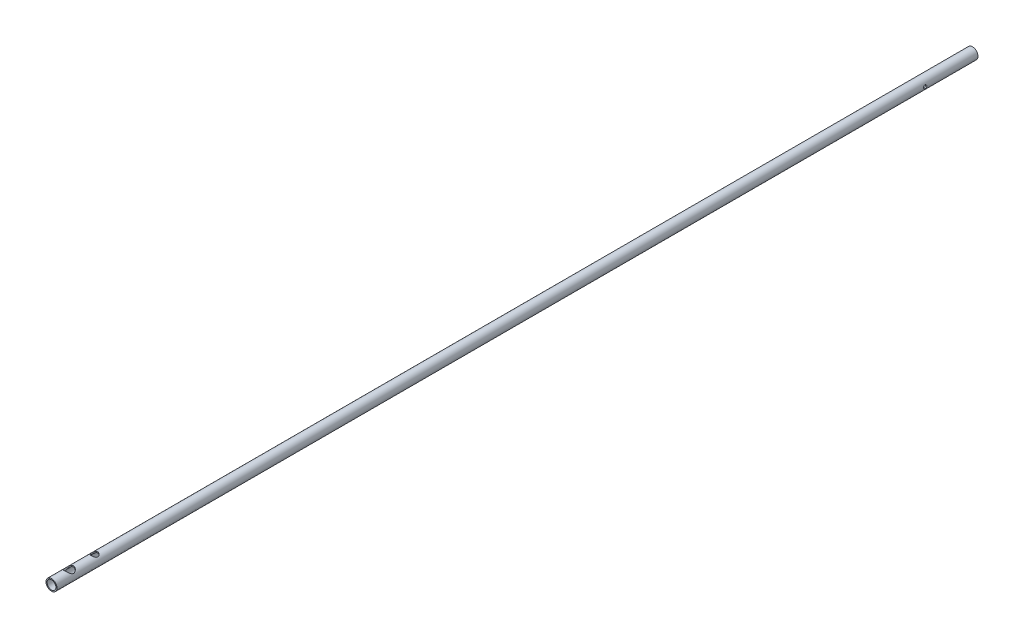
from build123d import *

# Parameters (mm, degrees)
SKETCH_1_R               = 5
SKETCH_1_R_2             = 4
EXTRUDE_1_DEPTH          = 836.5
CUT_EXTRUDE_1_DEPTH      = 837.529885898
CUT_EXTRUDE_1_DEPTH_BACK = 837.529885898
SKETCH_2_R               = 2
SKETCH_2_R_2             = 1.5
SKETCH_2_3_R             = 4
SKETCH_2_3_R_2           = 3
CUT_EXTRUDE_2_DEPTH      = 837.529885999
CUT_EXTRUDE_3_DEPTH      = 837.529885999
CUT_EXTRUDE_3_DEPTH_BACK = 837.529885999
SKETCH_3_R               = 1.5
SKETCH_3_3_R             = 3
CUT_EXTRUDE_4_DEPTH      = 10


with BuildPart() as part:
    # ｽｹｯﾁ1 → 押し出し-薄板1 (new body)
    with BuildSketch(Plane.XY):
        Circle(SKETCH_1_R)
        Circle(SKETCH_1_R_2, mode=Mode.SUBTRACT)
    extrude(amount=EXTRUDE_1_DEPTH)

    # ｽｹｯﾁ2 → ｶｯﾄ - 押し出し1 (cut, two sides: drawn at the far end of the back side and taken through both)
    with BuildSketch(Plane(origin=(0, 0, 0), x_dir=(1, 0, 0), z_dir=(0, 1, 0)).offset(-CUT_EXTRUDE_1_DEPTH_BACK)):
        with Locations((0, -820.5)):
            Circle(SKETCH_2_R)
        with Locations((0, -797.5)):
            Circle(SKETCH_2_R_2)
    extrude(amount=CUT_EXTRUDE_1_DEPTH + CUT_EXTRUDE_1_DEPTH_BACK, mode=Mode.SUBTRACT)

    # ｽｹｯﾁ2<3> → ｶｯﾄ - 押し出し2 (cut, through all)
    with BuildSketch(Plane(origin=(0, 0, 0), x_dir=(1, 0, 0), z_dir=(0, 1, 0))):
        with Locations((0, -820.5)):
            Circle(SKETCH_2_3_R)
        with Locations((0, -797.5)):
            Circle(SKETCH_2_3_R_2)
    extrude(amount=CUT_EXTRUDE_2_DEPTH, mode=Mode.SUBTRACT)

    # ｽｹｯﾁ3 → ｶｯﾄ - 押し出し3 (cut, two sides: drawn at the far end of the back side and taken through both)
    with BuildSketch(Plane(origin=(0, 0, 0), x_dir=(0, 0, -1), z_dir=(1, 0, 0)).offset(-CUT_EXTRUDE_3_DEPTH_BACK)):
        with Locations((-48, 0)):
            Circle(SKETCH_3_R)
    extrude(amount=CUT_EXTRUDE_3_DEPTH + CUT_EXTRUDE_3_DEPTH_BACK, mode=Mode.SUBTRACT)

    # ｽｹｯﾁ3<3> → ｶｯﾄ - 押し出し4 (cut)
    with BuildSketch(Plane(origin=(0, 0, 0), x_dir=(0, 0, -1), z_dir=(1, 0, 0))):
        with Locations((-48, 0)):
            Circle(SKETCH_3_3_R)
    extrude(amount=-CUT_EXTRUDE_4_DEPTH, mode=Mode.SUBTRACT)


solid = part.part
